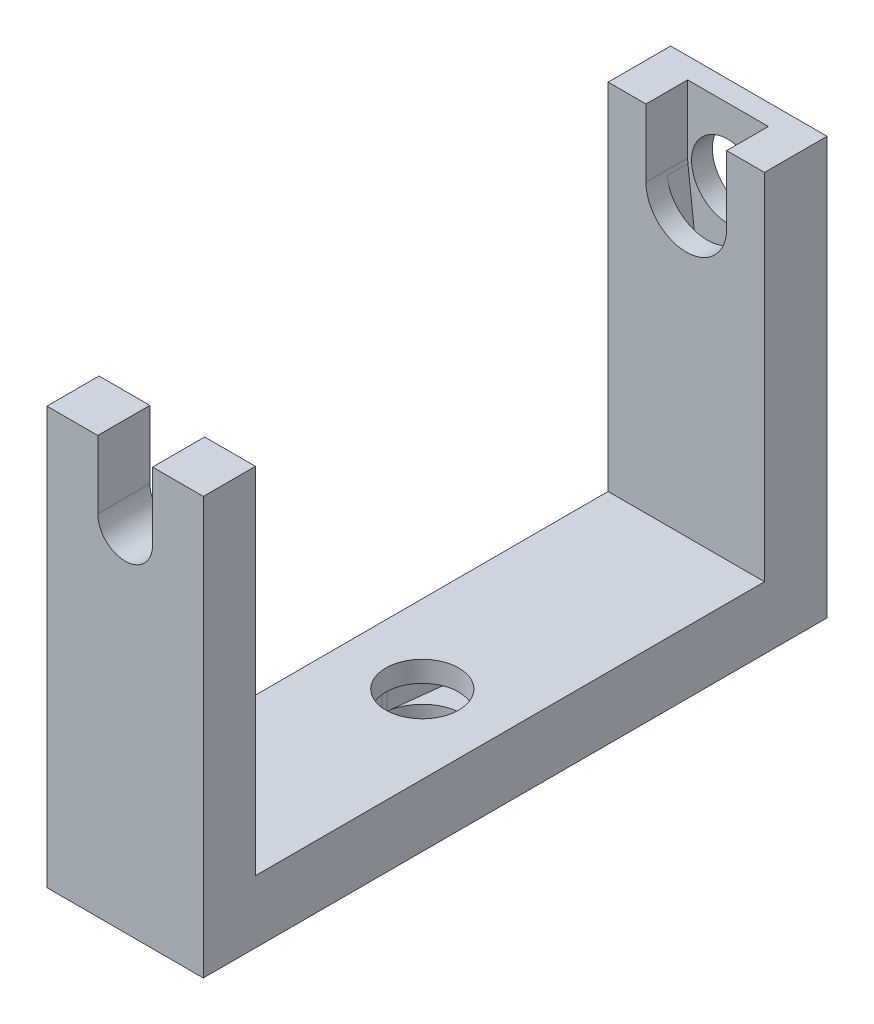
from build123d import *

# Parameters (mm, degrees)
BOSS_EXTRUDE1_DEPTH = 7.5
SKETCH2_R           = 3.5
CUT_EXTRUDE1_DEPTH  = 44.649720503
SKETCH6_R           = 3.5
CUT_EXTRUDE4_DEPTH  = 52.358372248
CUT_EXTRUDE5_DEPTH  = 1
CUT_EXTRUDE6_DEPTH  = 53.041544942
CUT_EXTRUDE7_DEPTH  = 1
CUT_EXTRUDE8_DEPTH  = 44.649720503
BOSS_EXTRUDE2_DEPTH = 22
BOSS_EXTRUDE3_START = -40
SKETCH12_W          = 15
SKETCH12_H          = 5
BOSS_EXTRUDE3_DEPTH = 40
CUT_EXTRUDE9_DEPTH  = 5


with BuildPart() as part:
    # Sketch1 → Boss-Extrude1 (new, symmetric)
    with BuildSketch(Plane(origin=(0, 0, 0), x_dir=(0, 0, -1), z_dir=(1, 0, 0))):
        Polygon((-15.91, -3), (-15.91, 3), (15.91, 3), (15.91, 37), (21.91, 37), (21.91, -3), align=None)
    extrude(amount=BOSS_EXTRUDE1_DEPTH, both=True)

    # Sketch2 → Cut-Extrude1 (cut, through all)
    with BuildSketch(Plane(origin=(0, 0, 0), x_dir=(1, 0, 0), z_dir=(0, 1, 0))):
        with Locations(Location((0, -9.41, 0), (0, 0, 90))):
            Circle(SKETCH2_R)
    extrude(amount=CUT_EXTRUDE1_DEPTH, mode=Mode.SUBTRACT)

    # Sketch6 → Cut-Extrude4 (cut, through all)
    with BuildSketch(Plane.XY.offset(-18.91)):
        with Locations((0, 30.5)):
            Circle(SKETCH6_R)
    extrude(amount=-CUT_EXTRUDE4_DEPTH, mode=Mode.SUBTRACT)

    # Sketch7 → Cut-Extrude5 (cut, symmetric)
    with BuildSketch(Plane.XY.offset(-18.91)):
        with BuildLine():
            Line((2.235057553, 16.161122159), (3.84429899, 30.054730114))
            ThreePointArc((3.84429899, 30.054730114), (3.863569405, 30.276994499), (3.87, 30.5))
            Line((3.87, 30.5), (3.87, 37))
            Line((3.87, 37), (-3.87, 37))
            Line((-3.87, 37), (-3.87, 30.5))
            ThreePointArc((-3.87, 30.5), (-3.863569405, 30.276994499), (-3.84429899, 30.054730114))
            Line((-3.84429899, 30.054730114), (-2.235057553, 16.161122159))
            ThreePointArc((-2.235057553, 16.161122159), (0, 14.17), (2.235057553, 16.161122159))
        make_face()
    extrude(amount=CUT_EXTRUDE5_DEPTH, both=True, mode=Mode.SUBTRACT)

    # Sketch8 → Cut-Extrude6 (cut, through all)
    with BuildSketch(Plane.XY.offset(-19.91)):
        with BuildLine():
            Line((3.87, 30.5), (3.87, 37))
            Line((3.87, 37), (-3.87, 37))
            Line((-3.87, 37), (-3.87, 30.5))
            ThreePointArc((-3.87, 30.5), (0, 26.63), (3.87, 30.5))
        make_face()
    extrude(amount=CUT_EXTRUDE6_DEPTH, mode=Mode.SUBTRACT)

    # Sketch9 → Cut-Extrude7 (cut, symmetric)
    with BuildSketch(Plane(origin=(0, 0, 0), x_dir=(1, 0, 0), z_dir=(0, 1, 0))):
        with BuildLine():
            Line((-3.87, -9.41), (-3.87, -15.91))
            Line((-3.87, -15.91), (3.87, -15.91))
            Line((3.87, -15.91), (3.87, -9.41))
            ThreePointArc((3.87, -9.41), (3.863569405, -9.186994499), (3.84429899, -8.964730114))
            Line((3.84429899, -8.964730114), (2.235057553, 4.928877841))
            ThreePointArc((2.235057553, 4.928877841), (0, 6.92), (-2.235057553, 4.928877841))
            Line((-2.235057553, 4.928877841), (-3.84429899, -8.964730114))
            ThreePointArc((-3.84429899, -8.964730114), (-3.863569405, -9.186994499), (-3.87, -9.41))
        make_face()
    extrude(amount=CUT_EXTRUDE7_DEPTH, both=True, mode=Mode.SUBTRACT)

    # Sketch10 → Cut-Extrude8 (cut, through all)
    with BuildSketch(Plane(origin=(0, 0, 0), x_dir=(1, 0, 0), z_dir=(0, 1, 0))):
        with BuildLine():
            Line((-3.87, -15.91), (3.87, -15.91))
            Line((3.87, -15.91), (3.87, -9.41))
            ThreePointArc((3.87, -9.41), (0, -5.54), (-3.87, -9.41))
            Line((-3.87, -9.41), (-3.87, -15.91))
        make_face()
    extrude(amount=-CUT_EXTRUDE8_DEPTH, mode=Mode.SUBTRACT)

    # Sketch11 → Boss-Extrude2 (add)
    with BuildSketch(Plane.XY.offset(15.91)):
        Polygon((-7.5, -3), (-3.87, -3), (-3.87, 1), (3.87, 1), (3.87, -3), (7.5, -3), (7.5, 3), (-7.5, 3), align=None)
    extrude(amount=BOSS_EXTRUDE2_DEPTH)

    # Sketch12 → Boss-Extrude3 (add)
    with BuildSketch(Plane.XZ.offset(3).offset(BOSS_EXTRUDE3_START)):
        with Locations((0, 35.41)):
            Rectangle(SKETCH12_W, SKETCH12_H)
    extrude(amount=BOSS_EXTRUDE3_DEPTH)

    # Sketch14 → Cut-Extrude9 (cut)
    with BuildSketch(Plane.XY.offset(37.91)):
        with BuildLine():
            Line((-2.625, 37), (-2.625, 30.5))
            ThreePointArc((-2.625, 30.5), (0, 27.875), (2.625, 30.5))
            Line((2.625, 30.5), (2.625, 37))
            Line((2.625, 37), (-2.625, 37))
        make_face()
    extrude(amount=-CUT_EXTRUDE9_DEPTH, mode=Mode.SUBTRACT)


solid = part.part
